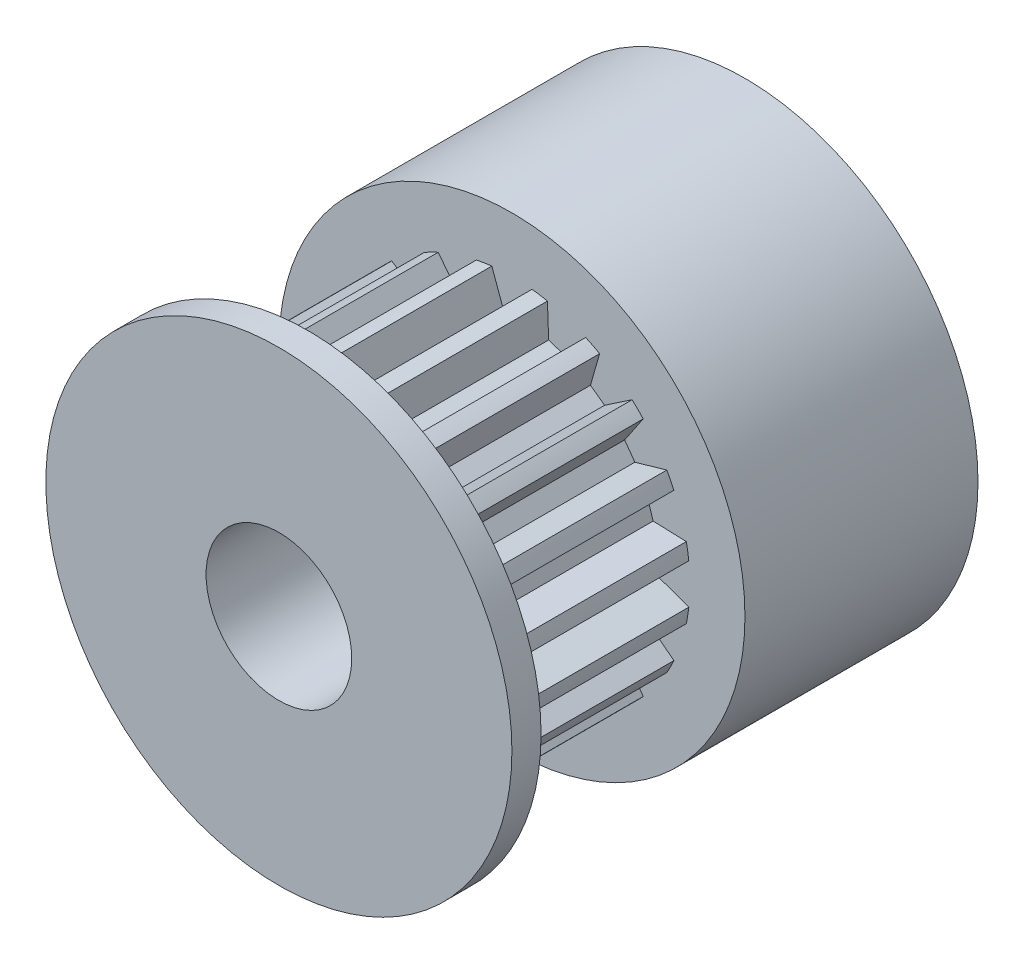
from build123d import *

# Parameters (mm, degrees)
SKETCH_1_R               = 6.11
SKETCH_1_R_2             = 2.5
EXTRUDE_1_DEPTH          = 16
SKETCH_1_3_R             = 8
SKETCH_1_3_R_2           = 6.11
EXTRUDE_2_DEPTH          = 8
EXTRUDE_START            = -1
SKETCH_2_R               = 8
SKETCH_2_R_2             = 6.11
EXTRUDE_3_DEPTH          = 1
CUT_EXTRUDE_5_DEPTH      = 7
PATTERN_CIRCULAR_1_COUNT = 20


with BuildPart() as part:
    # Эскиз1 → Бобышка-Вытянуть1 (new body)
    with BuildSketch(Plane.XY):
        Circle(SKETCH_1_R)
        Circle(SKETCH_1_R_2, mode=Mode.SUBTRACT)
    extrude(amount=EXTRUDE_1_DEPTH)

    # Эскиз1<3> → Бобышка-Вытянуть2 (add)
    with BuildSketch(Plane.XY):
        Circle(SKETCH_1_3_R)
        Circle(SKETCH_1_3_R_2, mode=Mode.SUBTRACT)
    extrude(amount=EXTRUDE_2_DEPTH)

    # Эскиз2 → Бобышка-Вытянуть3 (add)
    with BuildSketch(Plane.XY.offset(16).offset(EXTRUDE_START)):
        Circle(SKETCH_2_R)
        Circle(SKETCH_2_R_2, mode=Mode.SUBTRACT)
    extrude(amount=EXTRUDE_3_DEPTH)

    # Эскиз3 → Вырез-Вытянуть5 (cut)
    with BuildSketch(Plane.XY.offset(8)):
        with BuildLine():
            Line((-0.3, 5), (0.3, 5))
            Line((0.3, 5), (0.70385757, 6.109589554))
            ThreePointArc((0.70385757, 6.109589554), (0, 6.15), (-0.70385757, 6.109589554))
            Line((-0.70385757, 6.109589554), (-0.3, 5))
        make_face()
    cut_extrude_5 = extrude(amount=CUT_EXTRUDE_5_DEPTH, mode=Mode.SUBTRACT)

    # Круговой массив1: Вырез-Вытянуть5 ×20 about axis
    pattern_circular_1_axis = Axis((0, 0, 0), (0, 0, 1))
    for i in range(1, PATTERN_CIRCULAR_1_COUNT):
        add(cut_extrude_5.rotate(pattern_circular_1_axis, i * 360 / PATTERN_CIRCULAR_1_COUNT), mode=Mode.SUBTRACT)


solid = part.part
